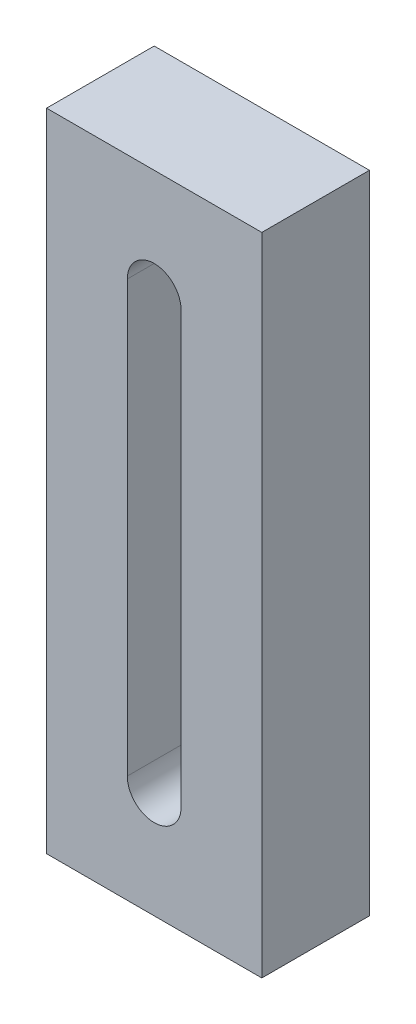
from build123d import *

# Parameters (mm, degrees)
SKETCH1_W               = 50.8
SKETCH1_H               = 152.4
BOSS_EXTRUDE1_DEPTH     = 25.4
CUT_EXTRUDE1_DEPTH      = 96.038097624
CUT_EXTRUDE1_DEPTH_BACK = 96.038097624


with BuildPart() as part:
    # Sketch1 → Boss-Extrude1 (new body)
    with BuildSketch(Plane.XY):
        with Locations((25.4, 0)):
            Rectangle(SKETCH1_W, SKETCH1_H)
    extrude(amount=BOSS_EXTRUDE1_DEPTH)

    # Sketch2 → Cut-Extrude1 (cut, two sides: drawn at the far end of the back side and taken through both)
    with BuildSketch(Plane.XY.offset(25.4).offset(-CUT_EXTRUDE1_DEPTH_BACK)):
        with BuildLine():
            Line((31.75, 50.8), (31.75, -50.8))
            ThreePointArc((31.75, -50.8), (25.4, -57.15), (19.05, -50.8))
            Line((19.05, -50.8), (19.05, 50.8))
            ThreePointArc((19.05, 50.8), (25.4, 57.15), (31.75, 50.8))
        make_face()
    extrude(amount=CUT_EXTRUDE1_DEPTH + CUT_EXTRUDE1_DEPTH_BACK, mode=Mode.SUBTRACT)


solid = part.part
